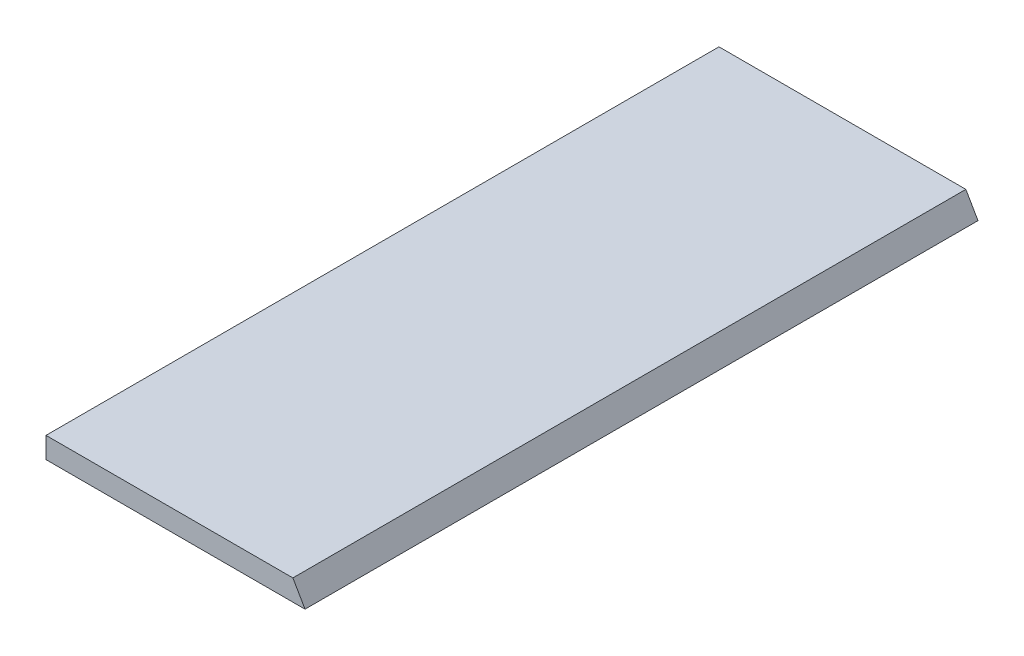
from build123d import *

# Parameters (mm, degrees)
SKETCH1_W           = 234.635149398
SKETCH1_H           = 609.6
BOSS_EXTRUDE1_DEPTH = 19.05
CUT_EXTRUDE1_DEPTH  = 622.078477999


with BuildPart() as part:
    # Sketch1 → Boss-Extrude1 (new body)
    with BuildSketch(Plane(origin=(0, 0, 0), x_dir=(1, 0, 0), z_dir=(0, 1, 0))):
        Rectangle(SKETCH1_W, SKETCH1_H)
    extrude(amount=BOSS_EXTRUDE1_DEPTH)

    # Sketch2 → Cut-Extrude1 (cut, through all)
    with BuildSketch(Plane.XY.offset(304.8)):
        Polygon((117.317574699, 19.05), (117.317574699, 0), (106.319052071, 19.05), align=None)
    extrude(amount=-CUT_EXTRUDE1_DEPTH, mode=Mode.SUBTRACT)


solid = part.part
